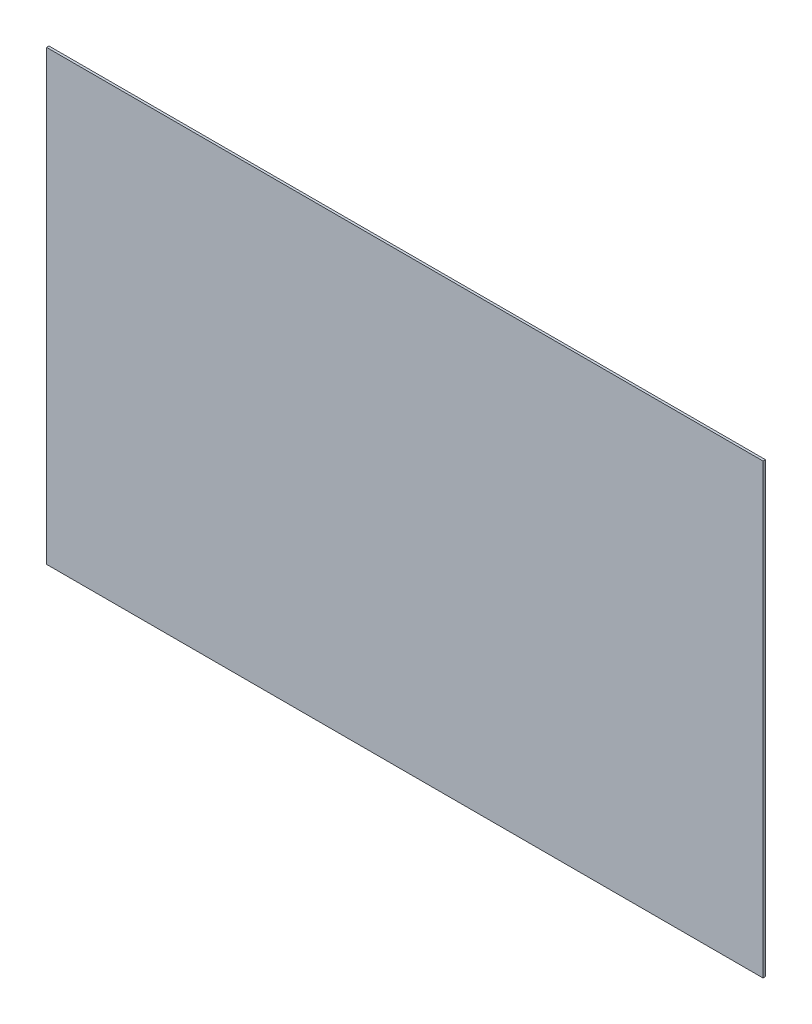
from build123d import *

# Parameters (mm, degrees)
SKETCH1_W        = 1200
SKETCH1_H        = 4
BACK_PANEL_DEPTH = 750


with BuildPart() as part:
    # Sketch1 → Back Panel (new body)
    with BuildSketch(Plane(origin=(0, -750, 0), x_dir=(-1, 0, 0), z_dir=(0, 1, 0))):
        with Locations((600, -2)):
            Rectangle(SKETCH1_W, SKETCH1_H)
    extrude(amount=BACK_PANEL_DEPTH)


solid = part.part
